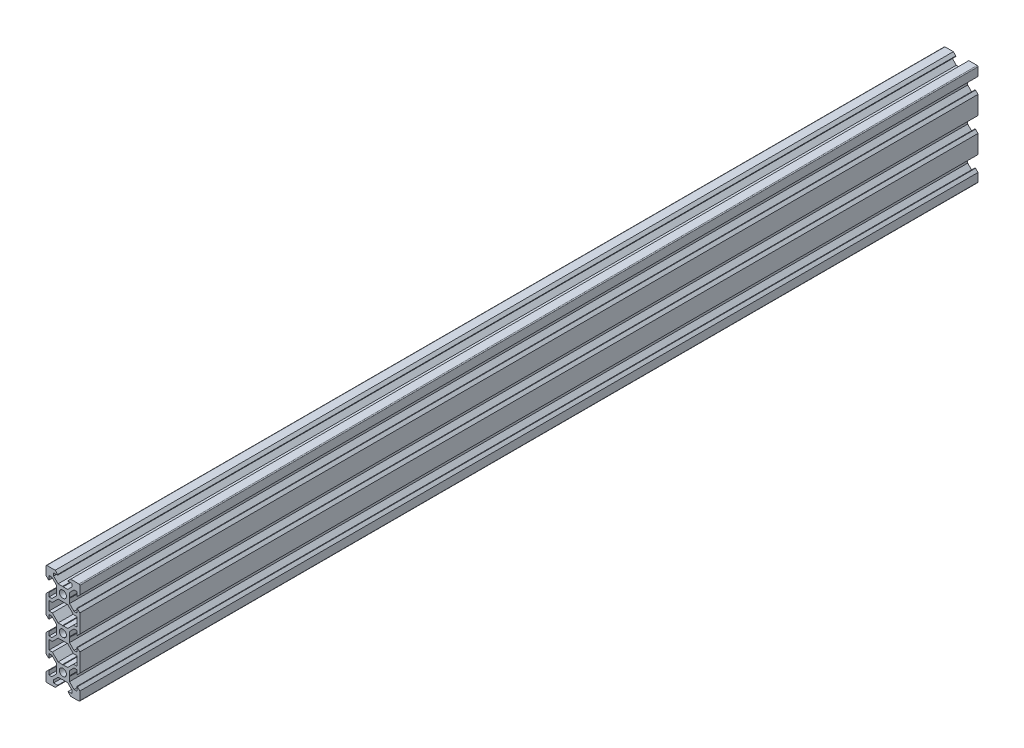
from build123d import *

# Parameters (mm, degrees)
BOSS_EXTRU_1_DEPTH = 531.13


with BuildPart() as part:
    # Esquisse1 → Boss.-Extru.1 (new body)
    with BuildSketch(Plane.XY):
        with BuildLine():
            Line((-9.5, 10), (-4.58, 10))
            Line((-4.58, 10), (-3.125, 8.545))
            Line((-3.125, 8.545), (-3.125, 8.2))
            Line((-3.125, 8.2), (-5.5, 8.2))
            Line((-5.5, 8.2), (-5.5, 6.560660172))
            Line((-5.5, 6.560660172), (-2.839339828, 3.9))
            Line((-2.839339828, 3.9), (-0.21, 3.9))
            Line((-0.21, 3.9), (0, 3.69))
            Line((0, 3.69), (0, 2.1))
            ThreePointArc((0, 2.1), (-2.1, 0), (0, -2.1))
            Line((0, -2.1), (0, -3.69))
            Line((0, -3.69), (-0.21, -3.9))
            Line((-0.21, -3.9), (-2.839339828, -3.9))
            Line((-2.839339828, -3.9), (-6.239339828, -7.3))
            Line((-6.239339828, -7.3), (-8.2, -7.3))
            Line((-8.2, -7.3), (-8.2, -12.7))
            Line((-8.2, -12.7), (-6.239339828, -12.7))
            Line((-6.239339828, -12.7), (-2.839339828, -16.1))
            Line((-2.839339828, -16.1), (-0.21, -16.1))
            Line((-0.21, -16.1), (0, -16.31))
            Line((0, -16.31), (0, -17.9))
            ThreePointArc((0, -17.9), (-2.1, -20), (0, -22.1))
            Line((0, -22.1), (0, -23.69))
            Line((0, -23.69), (-0.21, -23.9))
            Line((-0.21, -23.9), (-2.839339828, -23.9))
            Line((-2.839339828, -23.9), (-6.239339828, -27.3))
            Line((-6.239339828, -27.3), (-8.2, -27.3))
            Line((-8.2, -27.3), (-8.2, -32.7))
            Line((-8.2, -32.7), (-6.239339828, -32.7))
            Line((-6.239339828, -32.7), (-2.839339828, -36.1))
            Line((-2.839339828, -36.1), (-0.21, -36.1))
            Line((-0.21, -36.1), (0, -36.31))
            Line((0, -36.31), (0, -37.9))
            ThreePointArc((0, -37.9), (-2.1, -40), (0, -42.1))
            Line((0, -42.1), (0, -43.69))
            Line((0, -43.69), (-0.21, -43.9))
            Line((-0.21, -43.9), (-2.839339828, -43.9))
            Line((-2.839339828, -43.9), (-5.5, -46.560660172))
            Line((-5.5, -46.560660172), (-5.5, -48.2))
            Line((-5.5, -48.2), (-3.125, -48.2))
            Line((-3.125, -48.2), (-3.125, -48.545))
            Line((-3.125, -48.545), (-4.58, -50))
            Line((-4.58, -50), (-9.5, -50))
            ThreePointArc((-9.5, -50), (-9.853553391, -49.853553391), (-10, -49.5))
            Line((-10, -49.5), (-10, -44.58))
            Line((-10, -44.58), (-8.545, -43.125))
            Line((-8.545, -43.125), (-8.2, -43.125))
            Line((-8.2, -43.125), (-8.2, -45.5))
            Line((-8.2, -45.5), (-6.560660172, -45.5))
            Line((-6.560660172, -45.5), (-3.9, -42.839339828))
            Line((-3.9, -42.839339828), (-3.9, -40.21))
            Line((-3.9, -40.21), (-3.69, -40))
            Line((-3.69, -40), (-3.9, -39.79))
            Line((-3.9, -39.79), (-3.9, -37.160660172))
            Line((-3.9, -37.160660172), (-6.560660172, -34.5))
            Line((-6.560660172, -34.5), (-8.2, -34.5))
            Line((-8.2, -34.5), (-8.2, -36.875))
            Line((-8.2, -36.875), (-8.545, -36.875))
            Line((-8.545, -36.875), (-10, -35.42))
            Line((-10, -35.42), (-10, -24.58))
            Line((-10, -24.58), (-8.545, -23.125))
            Line((-8.545, -23.125), (-8.2, -23.125))
            Line((-8.2, -23.125), (-8.2, -25.5))
            Line((-8.2, -25.5), (-6.560660172, -25.5))
            Line((-6.560660172, -25.5), (-3.9, -22.839339828))
            Line((-3.9, -22.839339828), (-3.9, -20.21))
            Line((-3.9, -20.21), (-3.69, -20))
            Line((-3.69, -20), (-3.9, -19.79))
            Line((-3.9, -19.79), (-3.9, -17.160660172))
            Line((-3.9, -17.160660172), (-6.560660172, -14.5))
            Line((-6.560660172, -14.5), (-8.2, -14.5))
            Line((-8.2, -14.5), (-8.2, -16.875))
            Line((-8.2, -16.875), (-8.545, -16.875))
            Line((-8.545, -16.875), (-10, -15.42))
            Line((-10, -15.42), (-10, -4.58))
            Line((-10, -4.58), (-8.545, -3.125))
            Line((-8.545, -3.125), (-8.2, -3.125))
            Line((-8.2, -3.125), (-8.2, -5.5))
            Line((-8.2, -5.5), (-6.560660172, -5.5))
            Line((-6.560660172, -5.5), (-3.9, -2.839339828))
            Line((-3.9, -2.839339828), (-3.9, -0.21))
            Line((-3.9, -0.21), (-3.69, 0))
            Line((-3.69, 0), (-3.9, 0.21))
            Line((-3.9, 0.21), (-3.9, 2.839339828))
            Line((-3.9, 2.839339828), (-6.560660172, 5.5))
            Line((-6.560660172, 5.5), (-8.2, 5.5))
            Line((-8.2, 5.5), (-8.2, 3.125))
            Line((-8.2, 3.125), (-8.545, 3.125))
            Line((-8.545, 3.125), (-10, 4.58))
            Line((-10, 4.58), (-10, 9.5))
            ThreePointArc((-10, 9.5), (-9.853553391, 9.853553391), (-9.5, 10))
        make_face()
    boss_extru_1 = extrude(amount=BOSS_EXTRU_1_DEPTH)

    # Symétrie1: Boss.-Extru.1 across plane
    add(boss_extru_1.mirror(Plane(origin=(0, 3.69, 531.13), x_dir=(0, 0, 1), z_dir=(-1, 0, 0))))


solid = part.part
